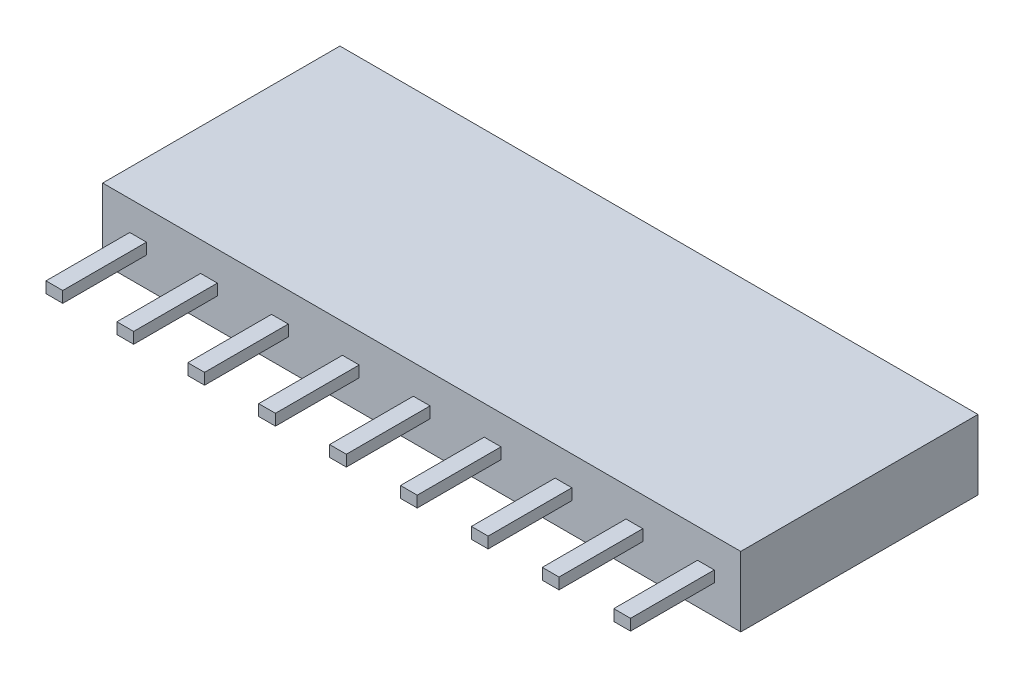
from build123d import *

# Parameters (mm, degrees)
SKETCH_1_W      = 22.86
SKETCH_1_H      = 8.5
EXTRUDE_1_DEPTH = 2.5
SKETCH_2_W      = 0.6
SKETCH_2_H      = 0.4
EXTRUDE_2_DEPTH = 3


with BuildPart() as part:
    # Эскиз1 → Бобышка-Вытянуть1 (new body)
    with BuildSketch(Plane(origin=(0, 0, 0), x_dir=(1, 0, 0), z_dir=(0, 1, 0))):
        Rectangle(SKETCH_1_W, SKETCH_1_H)
    extrude(amount=EXTRUDE_1_DEPTH)

    # Эскиз2 → Бобышка-Вытянуть2 (add)
    with BuildSketch(Plane.XY.offset(4.25)):
        with Locations((-7.62, 1.25)):
            Rectangle(SKETCH_2_W, SKETCH_2_H)
        with Locations((-10.16, 1.25)):
            Rectangle(SKETCH_2_W, SKETCH_2_H)
        with Locations((-5.08, 1.25)):
            Rectangle(SKETCH_2_W, SKETCH_2_H)
        with Locations((-2.54, 1.25)):
            Rectangle(SKETCH_2_W, SKETCH_2_H)
        with Locations((0, 1.25)):
            Rectangle(SKETCH_2_W, SKETCH_2_H)
        with Locations((2.54, 1.25)):
            Rectangle(SKETCH_2_W, SKETCH_2_H)
        with Locations((5.08, 1.25)):
            Rectangle(SKETCH_2_W, SKETCH_2_H)
        with Locations((7.62, 1.25)):
            Rectangle(SKETCH_2_W, SKETCH_2_H)
        with Locations((10.180976984, 1.25)):
            Rectangle(SKETCH_2_W, SKETCH_2_H)
    extrude(amount=EXTRUDE_2_DEPTH)


solid = part.part
